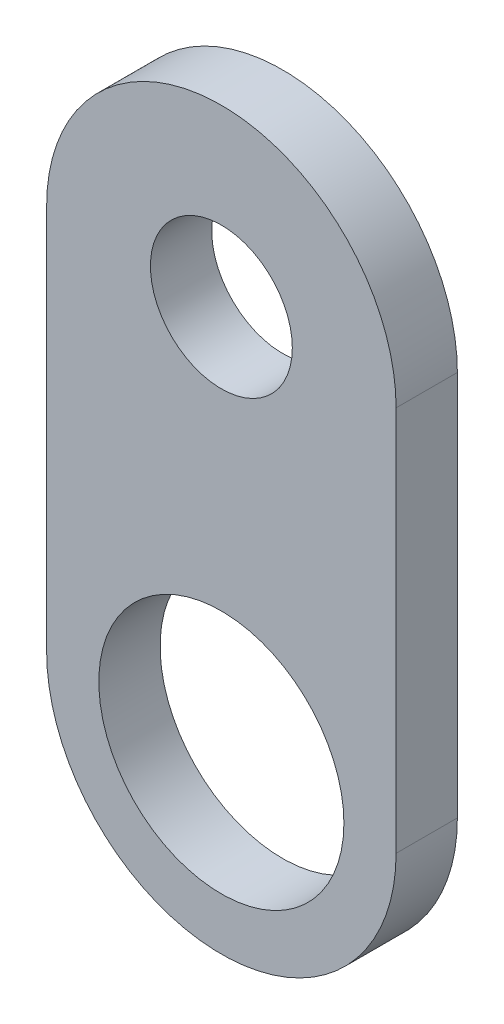
from build123d import *

# Parameters (mm, degrees)
SKETCH2_R           = 7.3533
SKETCH2_R_2         = 12.7
BOSS_EXTRUDE1_DEPTH = 6.35


with BuildPart() as part:
    # Sketch2 → Boss-Extrude1 (new body)
    with BuildSketch(Plane.XY):
        with BuildLine():
            Line((0, 0), (0, 39.981321055))
            ThreePointArc((0, 39.981321055), (18.109339472, 58.090660528), (36.218678945, 39.981321055))
            Line((36.218678945, 39.981321055), (36.218678945, 0))
            ThreePointArc((36.218678945, 0), (18.109339472, -18.109339472), (0, 0))
        make_face()
        with Locations((18.109339472, 39.981321055)):
            Circle(SKETCH2_R, mode=Mode.SUBTRACT)
        with Locations((18.109339472, 0)):
            Circle(SKETCH2_R_2, mode=Mode.SUBTRACT)
    extrude(amount=BOSS_EXTRUDE1_DEPTH)


solid = part.part
